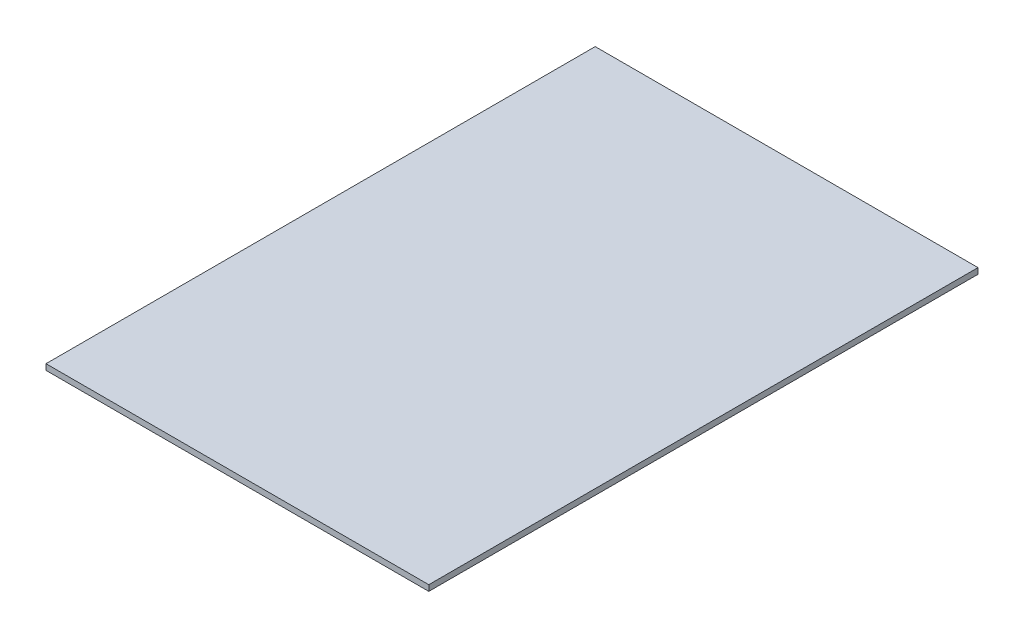
from build123d import *

# Parameters (mm, degrees)
ESBO_O1_W                = 230
ESBO_O1_H                = 330
RESSALTO_EXTRUS_O1_DEPTH = 3.5


with BuildPart() as part:
    # Esboço1 → Ressalto-extrusão1 (new body)
    with BuildSketch(Plane(origin=(0, 0, 0), x_dir=(1, 0, 0), z_dir=(0, 1, 0))):
        Rectangle(ESBO_O1_W, ESBO_O1_H)
    extrude(amount=RESSALTO_EXTRUS_O1_DEPTH)


solid = part.part
